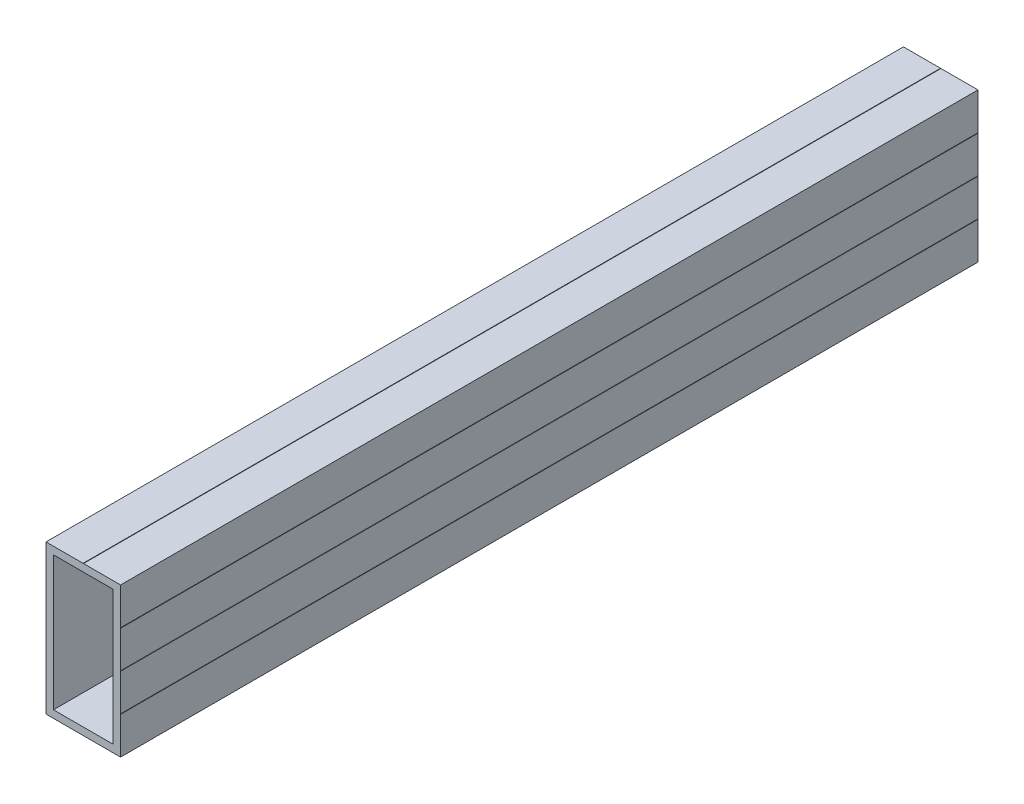
from build123d import *

# Parameters (mm, degrees)
SKETCH1_W           = 1498.6
SKETCH1_H           = 50.8
BOSS_EXTRUDE1_DEPTH = 25.4
CUT_EXTRUDE1_DEPTH  = 1498.6
CUT_EXTRUDE2_DEPTH  = 1499.869043646
CUT_EXTRUDE3_DEPTH  = 1498.6
CUT_EXTRUDE4_DEPTH  = 1498.6
CUT_EXTRUDE5_DEPTH  = 1499.869043646
CUT_EXTRUDE6_DEPTH  = 1499.869043646
CUT_EXTRUDE7_DEPTH  = 1498.6
CUT_EXTRUDE8_DEPTH  = 1498.6
SKETCH10_W          = 20.32
SKETCH10_H          = 45.72
CUT_EXTRUDE9_DEPTH  = 1499.869043646
DRAFT1_ANGLE        = 45
DRAFT2_ANGLE        = 45.000000005
DRAFT3_ANGLE        = 45
DRAFT4_ANGLE        = 45
DRAFT5_ANGLE        = 45
DRAFT6_ANGLE        = 44.999999995
SKETCH11_W          = 61.962293059
SKETCH11_H          = 88.678950317
CUT_EXTRUDE10_DEPTH = 1206.5


with BuildPart() as part:
    # Sketch1 → Boss-Extrude1 (new body)
    with BuildSketch(Plane(origin=(12.7, 0, 0), x_dir=(0, 0, -1), z_dir=(1, 0, 0))):
        Rectangle(SKETCH1_W, SKETCH1_H)
    extrude(amount=-BOSS_EXTRUDE1_DEPTH)

    # Sketch2 → Cut-Extrude1 (cut)
    with BuildSketch(Plane.XY.offset(749.3)):
        Polygon((0.0762, 25.4), (-0.0762, 25.4), (0.0762, 25.2476), align=None)
    extrude(amount=-CUT_EXTRUDE1_DEPTH, mode=Mode.SUBTRACT)

    # Sketch3 → Cut-Extrude2 (cut, through all)
    with BuildSketch(Plane.XY.offset(749.3)):
        Polygon((12.7, 12.6238), (12.7, 12.7762), (12.5476, 12.7762), align=None)
    extrude(amount=-CUT_EXTRUDE2_DEPTH, mode=Mode.SUBTRACT)

    # Sketch4 → Cut-Extrude3 (cut)
    with BuildSketch(Plane.XY.offset(749.3)):
        Polygon((12.7, -0.0762), (12.7, 0.0762), (12.5476, -0.0762), align=None)
    extrude(amount=-CUT_EXTRUDE3_DEPTH, mode=Mode.SUBTRACT)

    # Sketch5 → Cut-Extrude4 (cut)
    with BuildSketch(Plane.XY.offset(749.3)):
        Polygon((12.7, -12.7762), (12.7, -12.6238), (12.5476, -12.6238), align=None)
    extrude(amount=-CUT_EXTRUDE4_DEPTH, mode=Mode.SUBTRACT)

    # Sketch6 → Cut-Extrude5 (cut, through all)
    with BuildSketch(Plane.XY.offset(749.3)):
        Polygon((0.0762, -25.4), (-0.0762, -25.2476), (-0.0762, -25.4), align=None)
    extrude(amount=-CUT_EXTRUDE5_DEPTH, mode=Mode.SUBTRACT)

    # Sketch7 → Cut-Extrude6 (cut, through all)
    with BuildSketch(Plane.XY.offset(749.3)):
        Polygon((-12.7, -12.6238), (-12.7, -12.7762), (-12.5476, -12.7762), align=None)
    extrude(amount=-CUT_EXTRUDE6_DEPTH, mode=Mode.SUBTRACT)

    # Sketch8 → Cut-Extrude7 (cut)
    with BuildSketch(Plane.XY.offset(749.3)):
        Polygon((-12.7, 0.0762), (-12.7, -0.0762), (-12.5476, 0.0762), align=None)
    extrude(amount=-CUT_EXTRUDE7_DEPTH, mode=Mode.SUBTRACT)

    # Sketch9 → Cut-Extrude8 (cut)
    with BuildSketch(Plane.XY.offset(749.3)):
        Polygon((-12.7, 12.7762), (-12.7, 12.6238), (-12.5476, 12.6238), align=None)
    extrude(amount=-CUT_EXTRUDE8_DEPTH, mode=Mode.SUBTRACT)

    # Sketch10 → Cut-Extrude9 (cut, through all)
    with BuildSketch(Plane.XY.offset(749.3)):
        Rectangle(SKETCH10_W, SKETCH10_H)
    extrude(amount=-CUT_EXTRUDE9_DEPTH, mode=Mode.SUBTRACT)

    # Draft1
    draft1_faces = [part.faces().sort_by_distance(p)[0] for p in [
        (0.0762, 25.3238, 0),
    ]]
    draft(draft1_faces, Plane(origin=(-12.7, 25.4, -749.3), x_dir=(0, 0, 1), z_dir=(0, 1, 0)), DRAFT1_ANGLE)

    # Draft2
    draft2_faces = [part.faces().sort_by_distance(p)[0] for p in [
        (12.6238, 12.7762, 0),
    ]]
    draft(draft2_faces, Plane(origin=(12.7, 0, 0), x_dir=(0, 0, 1), z_dir=(1, 0, 0)), DRAFT2_ANGLE)

    # Draft3
    draft3_faces = [part.faces().sort_by_distance(p)[0] for p in [
        (-0.0762, -25.3238, 0),
    ]]
    draft(draft3_faces, Plane(origin=(-12.7, -25.4, 749.3), x_dir=(0, 0, -1), z_dir=(0, -1, 0)), DRAFT3_ANGLE)

    # Draft4
    draft4_faces = [part.faces().sort_by_distance(p)[0] for p in [
        (-12.6238, -12.7762, 0),
    ]]
    draft(draft4_faces, Plane(origin=(-12.7, 0, 0), x_dir=(0, 0, -1), z_dir=(-1, 0, 0)), DRAFT4_ANGLE)

    # Draft5
    draft5_faces = [part.faces().sort_by_distance(p)[0] for p in [
        (12.6238, -12.6238, 0),
        (12.6238, 0, 0),
    ]]
    draft(draft5_faces, Plane(origin=(12.7, 0, 0), x_dir=(0, 0, 1), z_dir=(1, 0, 0)), DRAFT5_ANGLE)

    # Draft6
    draft6_faces = [part.faces().sort_by_distance(p)[0] for p in [
        (-12.6238, 0, 0),
        (-12.6238, 12.6238, 0),
    ]]
    draft(draft6_faces, Plane(origin=(-12.7, 0, 0), x_dir=(0, 0, -1), z_dir=(-1, 0, 0)), DRAFT6_ANGLE)

    # Sketch11 → Cut-Extrude10 (cut)
    with BuildSketch(Plane(origin=(0, 0, -749.3), x_dir=(-1, 0, 0), z_dir=(0, 0, -1))):
        with Locations((-2.92473676, 0.325700182)):
            Rectangle(SKETCH11_W, SKETCH11_H)
    extrude(amount=-CUT_EXTRUDE10_DEPTH, mode=Mode.SUBTRACT)


solid = part.part
